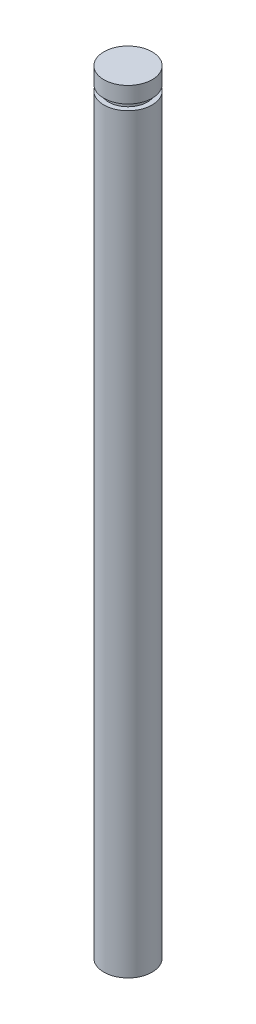
from build123d import *

# Parameters (mm, degrees)
SKETCH1_R           = 18.75
BOSS_EXTRUDE1_DEPTH = 12.5
SKETCH2_R           = 15
BOSS_EXTRUDE2_DEPTH = 4.5
BOSS_EXTRUDE3_START = 583
SKETCH3_R           = 18.75
BOSS_EXTRUDE3_DEPTH = 583


with BuildPart() as part:
    # Sketch1 → Boss-Extrude1 (new body)
    with BuildSketch(Plane(origin=(0, 0, 0), x_dir=(1, 0, 0), z_dir=(0, 1, 0))):
        with Locations(Location((0, 0, 0), (0, 0, 270))):
            Circle(SKETCH1_R)
    extrude(amount=BOSS_EXTRUDE1_DEPTH)

    # Sketch2 → Boss-Extrude2 (add)
    with BuildSketch(Plane.XZ):
        with Locations(Location((0, 0, 0), (0, 0, 270))):
            Circle(SKETCH2_R)
    extrude(amount=BOSS_EXTRUDE2_DEPTH)

    # Sketch3 → Boss-Extrude3 (add)
    with BuildSketch(Plane.XZ.offset(4.5).offset(BOSS_EXTRUDE3_START)):
        with Locations(Location((0, 0, 0), (0, 0, 90))):
            Circle(SKETCH3_R)
    extrude(amount=-BOSS_EXTRUDE3_DEPTH)


solid = part.part
